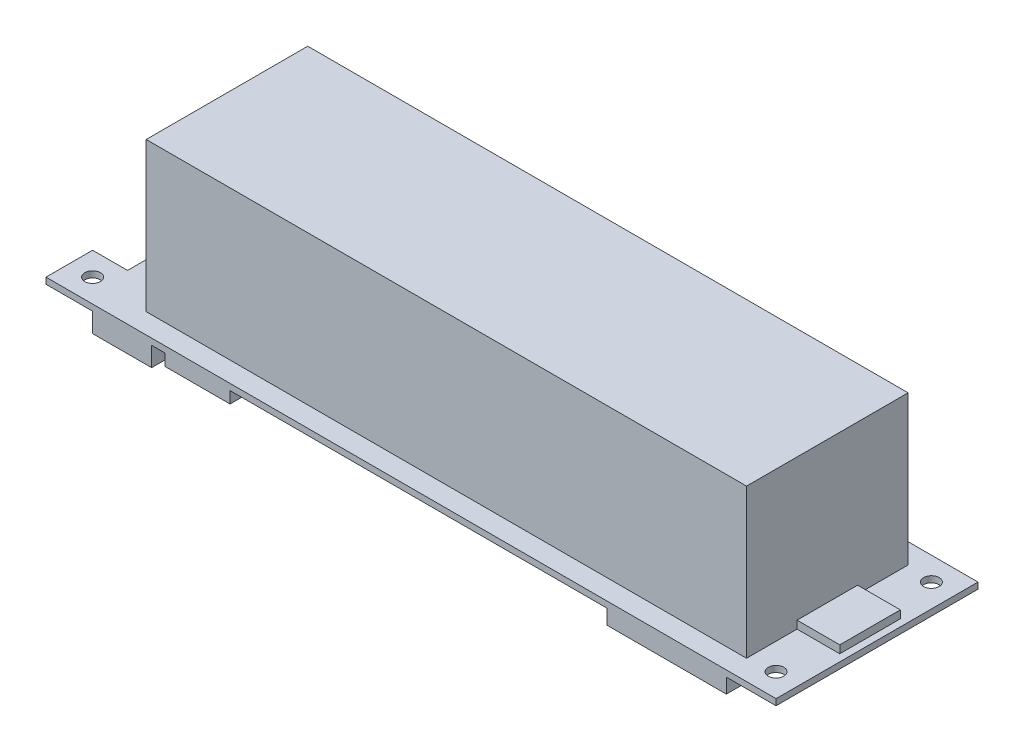
from build123d import *

# Parameters (mm, degrees)
SKETCH_1_W          = 94
SKETCH_1_H          = 26
SKETCH_1_R          = 1
EXTRUDE_1_DEPTH     = 0.8
SKETCH_2_W          = 5.5
SKETCH_2_H          = 7.8
EXTRUDE_2_DEPTH     = 1
SKETCH_2_3_W        = 77.3
SKETCH_2_3_H        = 20.8
EXTRUDE_3_DEPTH     = 19.2
SKETCH_3_W          = 15.4
SKETCH_3_H          = 15.1
EXTRUDE_4_DEPTH     = 1.9
SKETCH_3_3_W        = 6.7
SKETCH_3_3_H        = 6.2
EXTRUDE_5_DEPTH     = 1
SKETCH_3_4_W        = 8.4
SKETCH_3_4_H        = 5.9
EXTRUDE_6_DEPTH     = 1.5
SKETCH_3_5_W        = 7.6
SKETCH_3_5_H        = 5.9
EXTRUDE_7_DEPTH     = 2.5
SKETCH_3_6_W        = 4.5
SKETCH_3_6_H        = 8.7
CUT_EXTRUDE_1_DEPTH = 53.706735812


with BuildPart() as part:
    # 草图1 → 凸台-拉伸1 (new body)
    with BuildSketch(Plane(origin=(0, 0, 0), x_dir=(1, 0, 0), z_dir=(0, 1, 0))):
        Rectangle(SKETCH_1_W, SKETCH_1_H)
        with Locations((-44, 10)):
            Circle(SKETCH_1_R, mode=Mode.SUBTRACT)
        with Locations((-44, -10)):
            Circle(SKETCH_1_R, mode=Mode.SUBTRACT)
        with Locations((44, 10)):
            Circle(SKETCH_1_R, mode=Mode.SUBTRACT)
        with Locations((44, -10)):
            Circle(SKETCH_1_R, mode=Mode.SUBTRACT)
    extrude(amount=EXTRUDE_1_DEPTH)

    # 草图2 → 凸台-拉伸2 (add)
    with BuildSketch(Plane(origin=(0, 0.8, 0), x_dir=(1, 0, 0), z_dir=(0, 1, 0))):
        with Locations((-39.45, 0)):
            Rectangle(SKETCH_2_W, SKETCH_2_H)
        with Locations((43.35, 0)):
            Rectangle(SKETCH_2_W, SKETCH_2_H)
    extrude(amount=EXTRUDE_2_DEPTH)

    # 草图2<3> → 凸台-拉伸3 (add)
    with BuildSketch(Plane(origin=(0, 0.8, 0), x_dir=(1, 0, 0), z_dir=(0, 1, 0))):
        with Locations((1.95, 0)):
            Rectangle(SKETCH_2_3_W, SKETCH_2_3_H)
    extrude(amount=EXTRUDE_3_DEPTH)

    # 草图3 → 凸台-拉伸4 (add)
    with BuildSketch(Plane.XZ):
        with Locations((32.9, 5.45)):
            Rectangle(SKETCH_3_W, SKETCH_3_H)
    extrude(amount=EXTRUDE_4_DEPTH)

    # 草图3<3> → 凸台-拉伸5 (add)
    with BuildSketch(Plane.XZ):
        with Locations((-27.35, 0)):
            Rectangle(SKETCH_3_3_W, SKETCH_3_3_H)
        with Locations((-16.075, 0)):
            Rectangle(SKETCH_3_3_W, SKETCH_3_3_H)
        with Locations((-4.8, 0)):
            Rectangle(SKETCH_3_3_W, SKETCH_3_3_H)
        with Locations((6.475, 0)):
            Rectangle(SKETCH_3_3_W, SKETCH_3_3_H)
        with Locations((17.75, 0)):
            Rectangle(SKETCH_3_3_W, SKETCH_3_3_H)
    extrude(amount=EXTRUDE_5_DEPTH)

    # 草图3<4> → 凸台-拉伸6 (add)
    with BuildSketch(Plane.XZ):
        with Locations((-27.5, 10.05)):
            Rectangle(SKETCH_3_4_W, SKETCH_3_4_H)
    extrude(amount=EXTRUDE_6_DEPTH)

    # 草图3<5> → 凸台-拉伸7 (add)
    with BuildSketch(Plane.XZ):
        with Locations((-37.2, 10.05)):
            Rectangle(SKETCH_3_5_W, SKETCH_3_5_H)
    extrude(amount=EXTRUDE_7_DEPTH)

    # 草图3<6> → 切除-拉伸1 (cut, through all)
    with BuildSketch(Plane.XZ):
        with Locations((-44.75, 2.65)):
            Rectangle(SKETCH_3_6_W, SKETCH_3_6_H)
    extrude(amount=-CUT_EXTRUDE_1_DEPTH, mode=Mode.SUBTRACT)


solid = part.part
